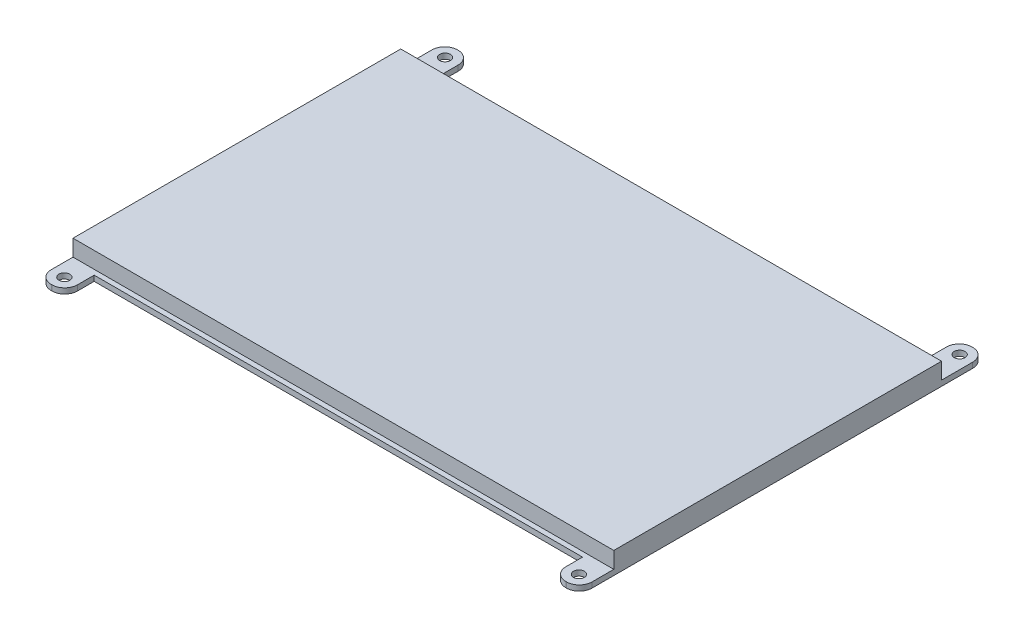
from build123d import *

# Parameters (mm, degrees)
SKETCH_1_W      = 165
SKETCH_1_H      = 100
EXTRUDE_1_DEPTH = 5
SKETCH_2_R      = 1.65
SKETCH_2_W      = 165
SKETCH_2_H      = 1.53
SKETCH_2_H_2    = 4.42
SKETCH_2_H_3    = 100
EXTRUDE_2_DEPTH = 1.65


with BuildPart() as part:
    # 草图1 → 凸台-拉伸1 (new body)
    with BuildSketch(Plane(origin=(0, 0, 0), x_dir=(1, 0, 0), z_dir=(0, 1, 0))):
        with Locations((8.779069767, 0)):
            Rectangle(SKETCH_1_W, SKETCH_1_H)
    extrude(amount=EXTRUDE_1_DEPTH)

    # 草图2 → 凸台-拉伸2 (add)
    # profile 1 of 7: a face of its own
    with BuildSketch(Plane.XZ):
        with BuildLine():
            Line((83.279069767, 51.53), (91.279069767, 51.53))
            Line((91.279069767, 51.53), (91.279069767, 56.63))
            ThreePointArc((91.279069767, 56.63), (90.136786214, 59.387716447), (87.379069767, 60.53))
            Line((87.379069767, 60.53), (87.179069767, 60.53))
            ThreePointArc((87.179069767, 60.53), (84.421353321, 59.387716447), (83.279069767, 56.63))
            Line((83.279069767, 56.63), (83.279069767, 51.53))
        make_face()
        with Locations(Location((87.279069767, 56.63, 0), (0, 0, 270))):
            Circle(SKETCH_2_R, mode=Mode.SUBTRACT)
    # profile 2 of 7: a face of its own
    with BuildSketch(Plane.XZ):
        with Locations((8.779069767, 50.765)):
            Rectangle(SKETCH_2_W, SKETCH_2_H)
    # profile 3 of 7: a face of its own
    with BuildSketch(Plane.XZ):
        with BuildLine():
            Line((-73.720930233, 56.63), (-73.720930233, 51.53))
            Line((-73.720930233, 51.53), (-65.720930233, 51.53))
            Line((-65.720930233, 51.53), (-65.720930233, 56.63))
            ThreePointArc((-65.720930233, 56.63), (-66.863213786, 59.387716447), (-69.620930233, 60.53))
            Line((-69.620930233, 60.53), (-69.820930233, 60.53))
            ThreePointArc((-69.820930233, 60.53), (-72.578646679, 59.387716447), (-73.720930233, 56.63))
        make_face()
        with Locations(Location((-69.720930233, 56.63, 0), (0, 0, 270))):
            Circle(SKETCH_2_R, mode=Mode.SUBTRACT)
    # profile 4 of 7: a face of its own
    with BuildSketch(Plane.XZ):
        with BuildLine():
            Line((-65.720930233, -54.42), (-73.720930233, -54.42))
            Line((-73.720930233, -54.42), (-73.720930233, -59.52))
            ThreePointArc((-73.720930233, -59.52), (-72.578646679, -62.277716447), (-69.820930233, -63.42))
            Line((-69.820930233, -63.42), (-69.620930233, -63.42))
            ThreePointArc((-69.620930233, -63.42), (-66.863213786, -62.277716447), (-65.720930233, -59.52))
            Line((-65.720930233, -59.52), (-65.720930233, -54.42))
        make_face()
        with Locations(Location((-69.720930233, -59.52, 0), (0, 0, 270))):
            Circle(SKETCH_2_R, mode=Mode.SUBTRACT)
    # profile 5 of 7: a face of its own
    with BuildSketch(Plane.XZ):
        with Locations((8.779069767, -52.21)):
            Rectangle(SKETCH_2_W, SKETCH_2_H_2)
    # profile 6 of 7: a face of its own
    with BuildSketch(Plane.XZ):
        with BuildLine():
            Line((91.279069767, -59.52), (91.279069767, -54.42))
            Line((91.279069767, -54.42), (83.279069767, -54.42))
            Line((83.279069767, -54.42), (83.279069767, -59.52))
            ThreePointArc((83.279069767, -59.52), (84.421353321, -62.277716447), (87.179069767, -63.42))
            Line((87.179069767, -63.42), (87.379069767, -63.42))
            ThreePointArc((87.379069767, -63.42), (90.136786214, -62.277716447), (91.279069767, -59.52))
        make_face()
        with Locations(Location((87.279069767, -59.52, 0), (0, 0, 270))):
            Circle(SKETCH_2_R, mode=Mode.SUBTRACT)
    # profile 7 of 7: a face of its own
    with BuildSketch(Plane.XZ):
        with Locations((8.779069767, 0)):
            Rectangle(SKETCH_2_W, SKETCH_2_H_3)
    extrude(amount=EXTRUDE_2_DEPTH)


solid = part.part
